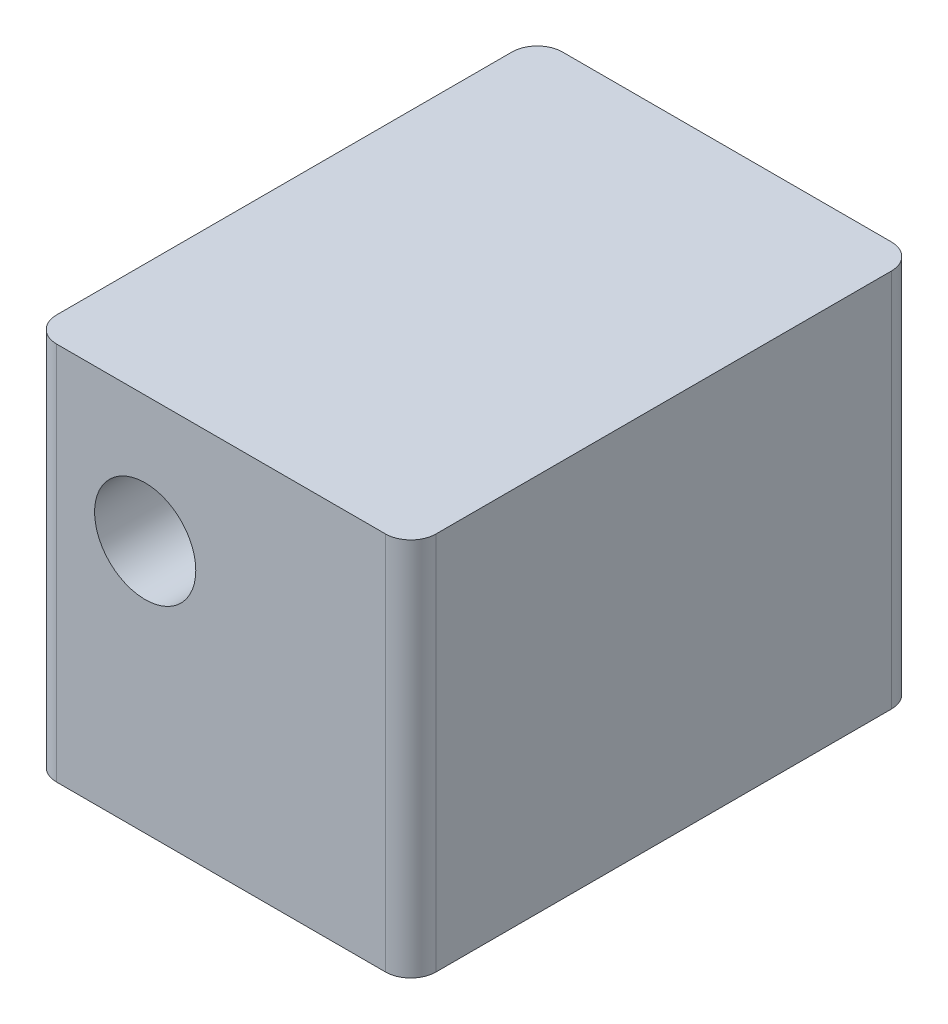
from build123d import *

# Parameters (mm, degrees)
BOSS_EXTRU_1_DEPTH      = 15
ESQUISSE2_R             = 2
ENL_V_MAT_EXTRU_1_DEPTH = 12
ESQUISSE3_R             = 2
ENL_V_MAT_EXTRU_2_DEPTH = 12
CONG_1_R                = 1


with BuildPart() as part:
    # Esquisse1 → Boss.-Extru.1 (new body)
    with BuildSketch(Plane(origin=(0, 0, 0), x_dir=(1, 0, 0), z_dir=(0, 1, 0))):
        Polygon((0, 0), (7.5, 0), (7.5, 20), (-7.5, 20), (-7.5, 0), align=None)
    extrude(amount=BOSS_EXTRU_1_DEPTH)

    # Esquisse2 → Enlèv. mat.-Extru.1 (cut)
    with BuildSketch(Plane.XZ):
        with Locations(Location((-3, -16, 0), (0, 0, 270))):
            Circle(ESQUISSE2_R)
        with Locations(Location((3, -4, 0), (0, 0, 270))):
            Circle(ESQUISSE2_R)
    extrude(amount=-ENL_V_MAT_EXTRU_1_DEPTH, mode=Mode.SUBTRACT)

    # Esquisse3 → Enlèv. mat.-Extru.2 (cut)
    with BuildSketch(Plane.XY):
        with Locations((-3, 10)):
            Circle(ESQUISSE3_R)
    extrude(amount=-ENL_V_MAT_EXTRU_2_DEPTH, mode=Mode.SUBTRACT)

    # Congé1
    cong_1_edges = [part.edges().sort_by_distance(p)[0] for p in [
        (-7.5, 7.5, 0),
        (-7.5, 7.5, -20),
        (7.5, 7.5, -20),
        (7.5, 7.5, 0),
    ]]
    fillet(cong_1_edges, radius=CONG_1_R)


solid = part.part
